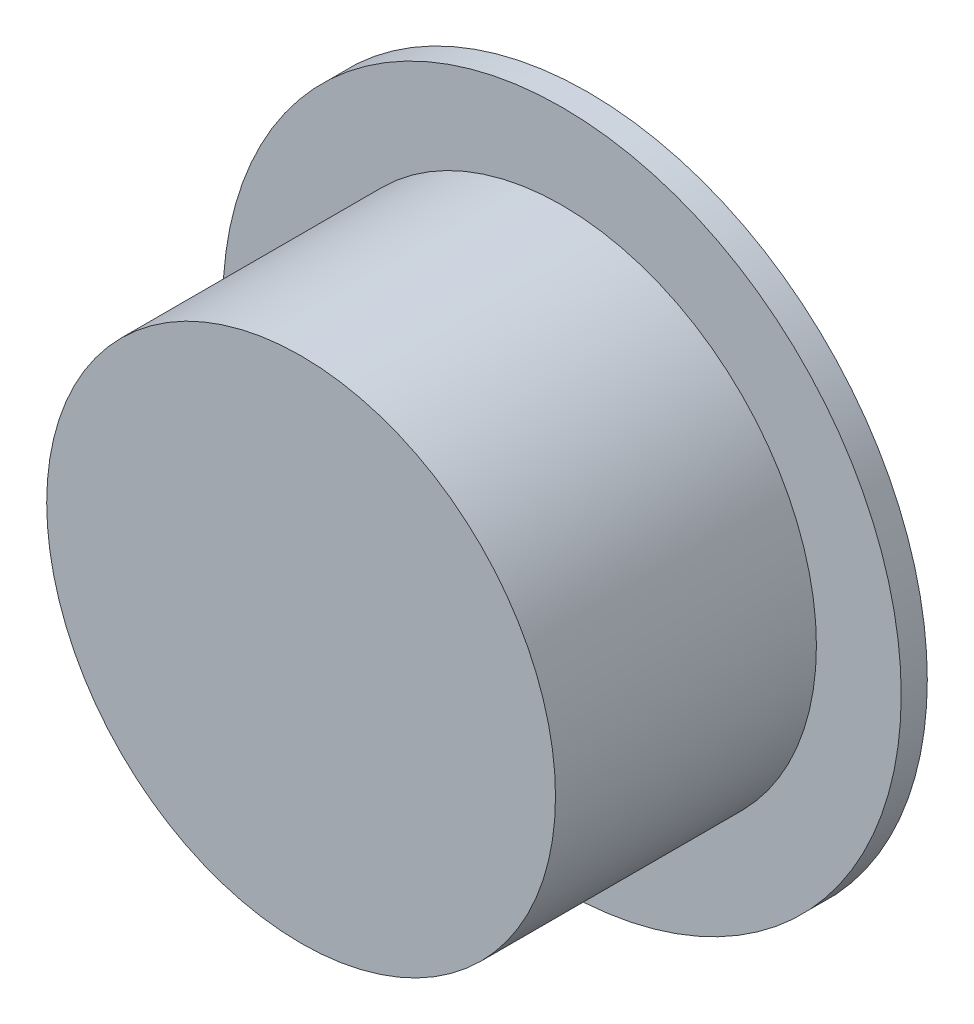
from build123d import *

# Parameters (mm, degrees)
SKETCH1_R           = 4.875
BOSS_EXTRUDE1_DEPTH = 5
SKETCH3_R           = 6.5
BOSS_EXTRUDE2_DEPTH = 0.5
SKETCH5_R           = 1.75
CUT_EXTRUDE1_DEPTH  = 0.75


with BuildPart() as part:
    # Sketch1 → Boss-Extrude1 (new body)
    with BuildSketch(Plane.XY):
        Circle(SKETCH1_R)
    extrude(amount=BOSS_EXTRUDE1_DEPTH)

    # Sketch3 → Boss-Extrude2 (add)
    with BuildSketch(Plane(origin=(0, 0, 0), x_dir=(-1, 0, 0), z_dir=(0, 0, -1))):
        Circle(SKETCH3_R)
    extrude(amount=BOSS_EXTRUDE2_DEPTH)

    # Sketch5 → Cut-Extrude1 (cut)
    with BuildSketch(Plane(origin=(0, 0, -0.5), x_dir=(-1, 0, 0), z_dir=(0, 0, -1))):
        Circle(SKETCH5_R)
    extrude(amount=-CUT_EXTRUDE1_DEPTH, mode=Mode.SUBTRACT)


solid = part.part
